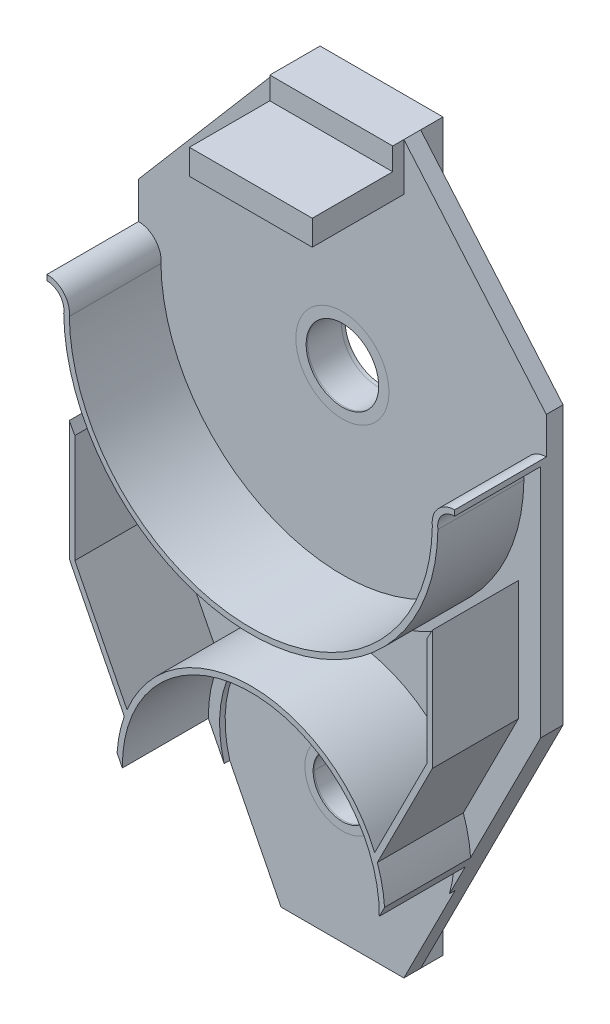
from build123d import *
from build123d.topology import SkipClean

# Parameters (mm, degrees)
PIASTRONEEXTR_DEPTH   = 30
LAMONE_DEPTH          = 40
CARTEREXT1_START      = 30
CARTEREXT1_DEPTH      = 10
CARTEREXT2_START      = 40
CARTEREXT2_DEPTH      = 154
IRRIGIDCIRC1_START    = 30
IRRIGIDCIRC1_DEPTH    = 10
IRRIGIDCIRC2_START    = 40
IRRIGIDCIRC2_DEPTH    = 154
IRRIGIDESTERNO1_START = 30
IRRIGIDESTERNO1_DEPTH = 10
IRRIGIDESTERNO2_START = 40
IRRIGIDESTERNO2_DEPTH = 154
RINFORZOSUP1_START    = 30
SKETCH12_W            = 110
SKETCH12_H            = 85
RINFORZOSUP1_DEPTH    = 20
BOSS_EXTRUDE1_START   = 50
SKETCH12_4_W          = 110
SKETCH12_4_H          = 45
BOSS_EXTRUDE1_DEPTH   = 144


with BuildPart() as part:
    # Piastrone → PiastroneExtr (new body)
    with BuildSketch(Plane.XY):
        with BuildLine():
            Line((-86.205427068, 491.905049747), (23.794572932, 491.905049747))
            Line((23.794572932, 491.905049747), (278.794572932, 193.153386451))
            Line((278.794572932, 193.153386451), (278.794572932, -303.297278914))
            Line((278.794572932, -303.297278914), (23.794572932, -808.094950253))
            Line((23.794572932, -808.094950253), (-86.205427068, -808.094950253))
            Line((-86.205427068, -808.094950253), (-86.205427068, -620.594950253))
            ThreePointArc((-86.205427068, -620.594950253), (-33.705427068, -568.094950253), (-86.205427068, -515.594950253))
            Line((-86.205427068, -515.594950253), (-86.205427068, 21.905049747))
            ThreePointArc((-86.205427068, 21.905049747), (-21.205427068, 86.905049747), (-86.205427068, 151.905049747))
            Line((-86.205427068, 151.905049747), (-86.205427068, 491.905049747))
        make_face()
    extrude(amount=PIASTRONEEXTR_DEPTH)


with BuildPart() as body_2:
    # Sketch14 → Lamone (new body)
    with BuildSketch(Plane(origin=(0, 0, 0), x_dir=(-1, 0, 0), z_dir=(0, 0, -1))):
        with BuildLine():
            Line((-23.794572932, 491.905049747), (86.205427068, 491.905049747))
            Line((86.205427068, 491.905049747), (86.205427068, 151.905049747))
            ThreePointArc((86.205427068, 151.905049747), (21.205427068, 86.905049747), (86.205427068, 21.905049747))
            Line((86.205427068, 21.905049747), (86.205427068, -515.594950253))
            ThreePointArc((86.205427068, -515.594950253), (33.705427068, -568.094950253), (86.205427068, -620.594950253))
            Line((86.205427068, -620.594950253), (86.205427068, -808.094950253))
            Line((86.205427068, -808.094950253), (-23.794572932, -808.094950253))
            Line((-23.794572932, -808.094950253), (-23.794572932, 491.905049747))
        make_face()
    extrude(amount=LAMONE_DEPTH)


with BuildPart() as body_3:
    # Carter → CarterExt1 (new body)
    with BuildSketch(Plane.XY.offset(CARTEREXT1_START)):
        with BuildLine():
            ThreePointArc((248.758008424, 81.95561707), (255.585083182, 106.603061749), (278.794572932, 117.346667498))
            Line((278.794572932, 117.346667498), (278.794572932, 86.905049747))
            ThreePointArc((278.794572932, 86.905049747), (171.888548065, -171.188925386), (-86.205427068, -278.094950253))
            Line((-86.205427068, -278.094950253), (-86.205427068, -248.094950253))
            ThreePointArc((-86.205427068, -248.094950253), (148.918944333, -151.719194564), (248.758008424, 81.95561707))
        make_face()
        with BuildLine():
            ThreePointArc((-86.205427068, -248.094950253), (148.918944333, -151.719194564), (248.758008424, 81.95561707))
            ThreePointArc((248.758008424, 81.95561707), (255.585083182, 106.603061749), (278.794572932, 117.346667498))
            Line((278.794572932, 117.346667498), (278.794572932, 127.247815787))
            ThreePointArc((278.794572932, 127.247815787), (248.567893296, 113.623706335), (238.756848588, 81.953342871))
            ThreePointArc((238.756848588, 81.953342871), (141.846864376, -144.648728817), (-86.205427068, -238.094950253))
            Line((-86.205427068, -238.094950253), (-86.205427068, -248.094950253))
        make_face()
    extrude(amount=CARTEREXT1_DEPTH)

    # Carter<4> → CarterExt2 (add)
    with BuildSketch(Plane.XY.offset(CARTEREXT2_START)):
        with BuildLine():
            ThreePointArc((-86.205427068, -248.094950253), (148.918944333, -151.719194564), (248.758008424, 81.95561707))
            ThreePointArc((248.758008424, 81.95561707), (255.585083182, 106.603061749), (278.794572932, 117.346667498))
            Line((278.794572932, 117.346667498), (278.794572932, 127.247815787))
            ThreePointArc((278.794572932, 127.247815787), (248.567893296, 113.623706335), (238.756848588, 81.953342871))
            ThreePointArc((238.756848588, 81.953342871), (141.846864376, -144.648728817), (-86.205427068, -238.094950253))
            Line((-86.205427068, -238.094950253), (-86.205427068, -248.094950253))
        make_face()
    extrude(amount=CARTEREXT2_DEPTH)


with BuildPart() as body_4:
    # IrrigidCirc → IrrigidCirc1 (new body)
    with BuildSketch(Plane.XY.offset(IRRIGIDCIRC1_START)):
        with BuildLine():
            ThreePointArc((-86.205427068, -338.094950253), (77.301662182, -406.337626569), (143.781261282, -570.569456643))
            Line((143.781261282, -570.569456643), (115.484539714, -626.585610189))
            ThreePointArc((115.484539714, -626.585610189), (81.697876334, -441.966124417), (-86.205427068, -358.094950253))
            Line((-86.205427068, -358.094950253), (-86.205427068, -338.094950253))
        make_face()
        with BuildLine():
            ThreePointArc((-86.205427068, -328.094950253), (77.651833725, -392.735895495), (153.243359331, -551.838299541))
            Line((153.243359331, -551.838299541), (143.781261282, -570.569456643))
            ThreePointArc((143.781261282, -570.569456643), (77.301662182, -406.337626569), (-86.205427068, -338.094950253))
            Line((-86.205427068, -338.094950253), (-86.205427068, -328.094950253))
        make_face()
    extrude(amount=IRRIGIDCIRC1_DEPTH)

    # IrrigidCirc<7> → IrrigidCirc2 (add)
    with BuildSketch(Plane.XY.offset(IRRIGIDCIRC2_START)):
        with BuildLine():
            ThreePointArc((-86.205427068, -328.094950253), (77.651833725, -392.735895495), (153.243359331, -551.838299541))
            Line((153.243359331, -551.838299541), (143.781261282, -570.569456643))
            ThreePointArc((143.781261282, -570.569456643), (77.301662182, -406.337626569), (-86.205427068, -338.094950253))
            Line((-86.205427068, -338.094950253), (-86.205427068, -328.094950253))
        make_face()
    extrude(amount=IRRIGIDCIRC2_DEPTH)


with BuildPart() as body_5:
    # Sketch9 → IrrigidEsterno1 (new body)
    with BuildSketch(Plane.XY.offset(IRRIGIDESTERNO1_START)):
        with BuildLine():
            Line((238.794572932, -293.767656293), (278.794572932, -303.297278914))
            Line((278.794572932, -303.297278914), (278.794572932, 86.905049747))
            ThreePointArc((278.794572932, 86.905049747), (268.653699911, 1.465012294), (238.794572932, -79.227427511))
            Line((238.794572932, -79.227427511), (238.794572932, -293.767656293))
        make_face()
        with BuildLine():
            Line((153.243359331, -551.838299541), (278.794572932, -303.297278914))
            Line((278.794572932, -303.297278914), (238.794572932, -293.767656293))
            Line((238.794572932, -293.767656293), (140.299029593, -488.749306939))
            ThreePointArc((140.299029593, -488.749306939), (148.897021721, -519.857635093), (153.243359331, -551.838299541))
        make_face()
        with BuildLine():
            Line((140.299029593, -488.749306939), (238.794572932, -293.767656293))
            Line((238.794572932, -293.767656293), (228.794572932, -291.385250638))
            Line((228.794572932, -291.385250638), (135.473141453, -476.124236116))
            ThreePointArc((135.473141453, -476.124236116), (137.974978228, -482.402792609), (140.299029593, -488.749306939))
        make_face()
        with BuildLine():
            Line((228.794572932, -291.385250638), (238.794572932, -293.767656293))
            Line((238.794572932, -293.767656293), (238.794572932, -79.227427511))
            ThreePointArc((238.794572932, -79.227427511), (233.924768948, -88.42794087), (228.794572932, -97.485839398))
            Line((228.794572932, -97.485839398), (228.794572932, -291.385250638))
        make_face()
    extrude(amount=IRRIGIDESTERNO1_DEPTH)

    # Sketch9<3> → IrrigidEsterno2 (add)
    with BuildSketch(Plane.XY.offset(IRRIGIDESTERNO2_START)):
        with BuildLine():
            Line((228.794572932, -291.385250638), (238.794572932, -293.767656293))
            Line((238.794572932, -293.767656293), (238.794572932, -79.227427511))
            ThreePointArc((238.794572932, -79.227427511), (233.924768948, -88.42794087), (228.794572932, -97.485839398))
            Line((228.794572932, -97.485839398), (228.794572932, -291.385250638))
        make_face()
        with BuildLine():
            Line((140.299029593, -488.749306939), (238.794572932, -293.767656293))
            Line((238.794572932, -293.767656293), (228.794572932, -291.385250638))
            Line((228.794572932, -291.385250638), (135.473141453, -476.124236116))
            ThreePointArc((135.473141453, -476.124236116), (137.974978228, -482.402792609), (140.299029593, -488.749306939))
        make_face()
    extrude(amount=IRRIGIDESTERNO2_DEPTH)


with BuildPart() as body_6:
    # Sketch12 → RinforzoSup1 (new body)
    with BuildSketch(Plane.XY.offset(RINFORZOSUP1_START)):
        with Locations((-31.205427068, 449.405049747)):
            Rectangle(SKETCH12_W, SKETCH12_H)
    extrude(amount=RINFORZOSUP1_DEPTH)

    # Sketch12<4> → Boss-Extrude1 (add)
    with BuildSketch(Plane.XY.offset(BOSS_EXTRUDE1_START)):
        with Locations((-31.205427068, 429.405049747)):
            Rectangle(SKETCH12_4_W, SKETCH12_4_H)
    extrude(amount=BOSS_EXTRUDE1_DEPTH)


with BuildPart() as body_2_1:
    add(body_2.part)

    # Combine11: union part, body 6, body 3, body 5, body 4
    add(part.part)
    add(body_6.part)
    add(body_3.part)
    add(body_5.part)
    add(body_4.part)

    # Mirror3: body 2 across plane


with BuildPart() as body_2_2:
    with SkipClean():  # the faces are left unmerged after this step: merging them gives an invalid solid
        add(body_2_1.part)
        add(body_2_1.part.mirror(Plane(origin=(-86.205427068, 491.905049747, -40), x_dir=(0, 0, 1), z_dir=(1, 0, 0))))


solid = body_2_2.part
